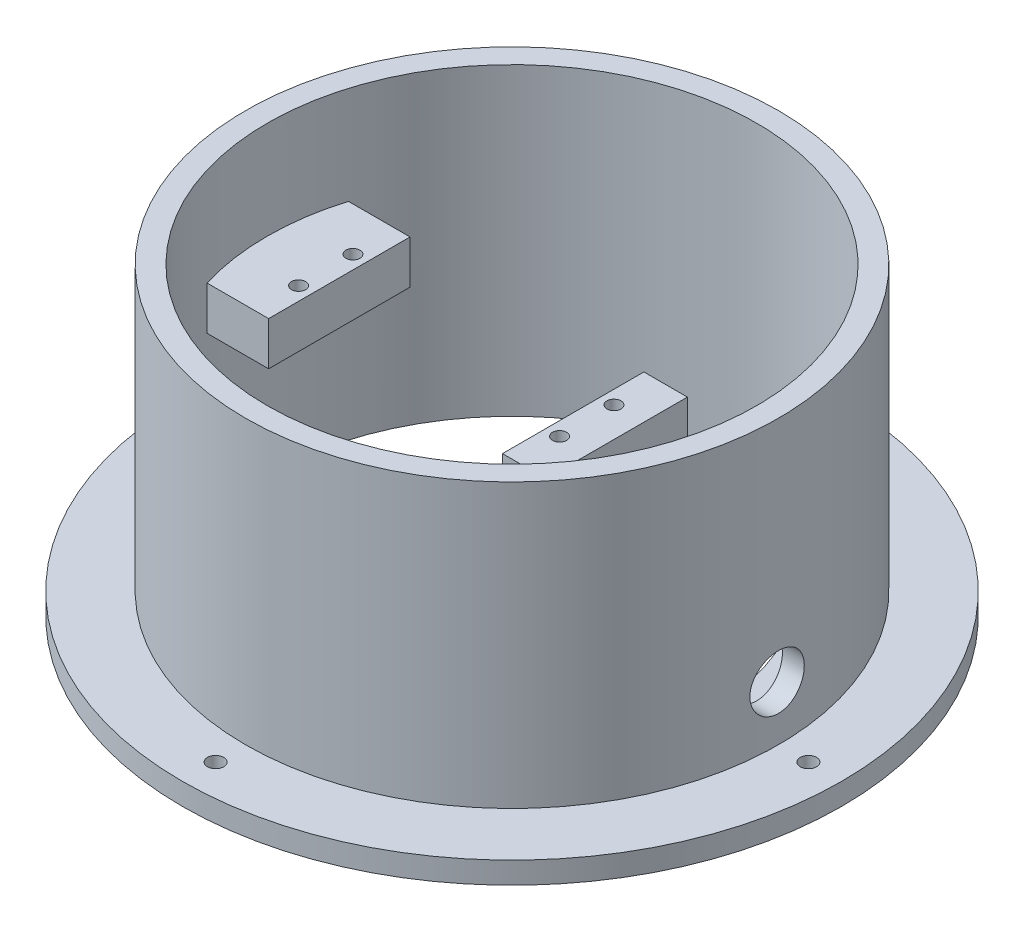
from build123d import *

# Parameters (mm, degrees)
SKETCH1_R           = 60.625
SKETCH1_R_2         = 45
BOSS_EXTRUDE1_DEPTH = 4
SKETCH2_R           = 49
SKETCH2_R_2         = 45
BOSS_EXTRUDE2_DEPTH = 52
SKETCH3_W           = 8
SKETCH3_H           = 38
SKETCH3_W_2         = 15
SKETCH3_H_2         = 8
BOSS_EXTRUDE3_DEPTH = 13
SKETCH4_W           = 10
SKETCH4_H           = 24
CUT_EXTRUDE1_DEPTH  = 8
SKETCH5_R           = 5
CUT_EXTRUDE2_DEPTH  = 110.441337026
SKETCH6_R           = 1.3
CUT_EXTRUDE3_DEPTH  = 7.2
BOSS_EXTRUDE4_DEPTH = 4
SKETCH8_R           = 1.5
CUT_EXTRUDE4_DEPTH  = 103.404986506


with BuildPart() as part:
    # Sketch1 → Boss-Extrude1 (new body)
    with BuildSketch(Plane(origin=(0, 0, 0), x_dir=(1, 0, 0), z_dir=(0, 1, 0))):
        with Locations(Location((0, 0, 0), (0, 0, 270))):
            Circle(SKETCH1_R)
        with Locations(Location((0, 0, 0), (0, 0, 270))):
            Circle(SKETCH1_R_2, mode=Mode.SUBTRACT)
    extrude(amount=BOSS_EXTRUDE1_DEPTH)

    # Sketch2 → Boss-Extrude2 (add)
    with BuildSketch(Plane(origin=(0, 4, 0), x_dir=(1, 0, 0), z_dir=(0, 1, 0))):
        with Locations(Location((0, 0, 0), (0, 0, 90))):
            Circle(SKETCH2_R)
        with Locations(Location((0, 0, 0), (0, 0, 270))):
            Circle(SKETCH2_R_2, mode=Mode.SUBTRACT)
    extrude(amount=BOSS_EXTRUDE2_DEPTH)

    # Sketch3 → Boss-Extrude3 (add, symmetric)
    with BuildSketch(Plane.XY):
        with Locations((15.25, 19)):
            Rectangle(SKETCH3_W, SKETCH3_H)
        with Locations((-39.25, 34)):
            Rectangle(SKETCH3_W_2, SKETCH3_H_2)
    extrude(amount=BOSS_EXTRUDE3_DEPTH, both=True)


with BuildPart() as boss_extrude3_piece_1:
    # of the separate pieces the step leaves, piece 1, a body of its own (boss_extrude3_pieces)
    add(part.part.solids().sort_by_distance((0, 0, 60.625))[0])

    # Sketch5 → Cut-Extrude2 (cut, through all)
    with BuildSketch(Plane.ZY.offset(-11.25)):
        with Locations((0, 14)):
            Circle(SKETCH5_R)
    extrude(amount=-CUT_EXTRUDE2_DEPTH, mode=Mode.SUBTRACT)


with BuildPart() as boss_extrude3_piece_2:
    # of the separate pieces the step leaves, piece 2, a body of its own (boss_extrude3_pieces)
    add(part.part.solids().sort_by_distance((11.25, 0, -13))[0])

    # Sketch4 → Cut-Extrude1 (cut)
    with BuildSketch(Plane.ZY.offset(-11.25)):
        with Locations((0, 17)):
            Rectangle(SKETCH4_W, SKETCH4_H)
    extrude(amount=-CUT_EXTRUDE1_DEPTH, mode=Mode.SUBTRACT)


with BuildPart() as cut_extrude3_tool:
    # Sketch6 → Cut-Extrude3 (new body)
    with BuildSketch(Plane(origin=(0, 38, 0), x_dir=(1, 0, 0), z_dir=(0, 1, 0))):
        with Locations(Location((-34.25, 5, 0), (0, 0, 270))):
            Circle(SKETCH6_R)
        with Locations(Location((-34.25, -5, 0), (0, 0, 270))):
            Circle(SKETCH6_R)
        with Locations(Location((13.75, 5, 0), (0, 0, 270))):
            Circle(SKETCH6_R)
        with Locations(Location((13.75, -5, 0), (0, 0, 270))):
            Circle(SKETCH6_R)
    extrude(amount=-CUT_EXTRUDE3_DEPTH)


with BuildPart() as boss_extrude3_piece_1_1:
    add(boss_extrude3_piece_1.part)

    # Cut-Extrude3: cut by cut_extrude3_tool
    add(cut_extrude3_tool.part, mode=Mode.SUBTRACT)



with BuildPart() as boss_extrude3_piece_2_1:
    add(boss_extrude3_piece_2.part)

    # Cut-Extrude3: cut by cut_extrude3_tool
    add(cut_extrude3_tool.part, mode=Mode.SUBTRACT)


with BuildPart() as boss_extrude3_piece_1_2:
    add(boss_extrude3_piece_1_1.part)

    add(boss_extrude3_piece_2_1.part)  # Boss-Extrude4 merges Boss-Extrude3 piece 2
    # Sketch7 → Boss-Extrude4 (add)
    with BuildSketch(Plane.XZ):
        with BuildLine():
            Line((11.25, 13), (25.249838503, 37.248431585))
            ThreePointArc((25.249838503, 37.248431585), (45, 0), (25.249838503, -37.248431585))
            Line((25.249838503, -37.248431585), (11.25, -13))
            Line((11.25, -13), (11.25, 13))
        make_face()
        with BuildLine():
            Line((24.25, 19.516660498), (27.361802413, 24.906460381))
            ThreePointArc((27.361802413, 24.906460381), (37, 0), (27.361802413, -24.906460381))
            Line((27.361802413, -24.906460381), (24.25, -19.516660498))
            Line((24.25, -19.516660498), (24.25, 19.516660498))
        make_face(mode=Mode.SUBTRACT)
    extrude(amount=-BOSS_EXTRUDE4_DEPTH)

    # Sketch8 → Cut-Extrude4 (cut, through all)
    with BuildSketch(Plane.XZ):
        with Locations(Location((54.5, 0, 0), (0, 0, 270))):
            Circle(SKETCH8_R)
        with Locations(Location((0, -54.5, 0), (0, 0, 270))):
            Circle(SKETCH8_R)
        with Locations(Location((-54.5, 0, 0), (0, 0, 270))):
            Circle(SKETCH8_R)
        with Locations(Location((0, 54.5, 0), (0, 0, 270))):
            Circle(SKETCH8_R)
    extrude(amount=-CUT_EXTRUDE4_DEPTH, mode=Mode.SUBTRACT)


solid = boss_extrude3_piece_1_2.part
